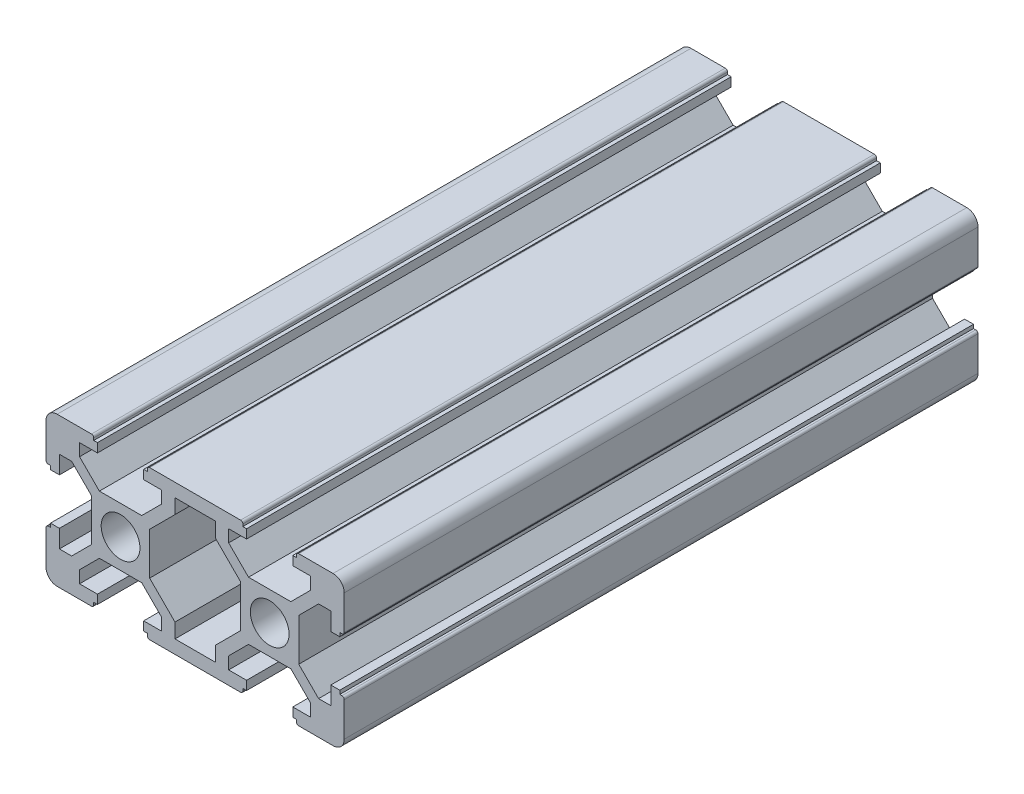
from build123d import *

# Parameters (mm, degrees)
SKETCH_1_R      = 2.6
EXTRUDE_1_DEPTH = 42.5
FILLET_1_R      = 1.5
FILLET_2_R      = 0.3


with BuildPart() as part:
    # 草图1 → 凸台-拉伸1 (new, symmetric)
    with BuildSketch(Plane.XY):
        Polygon((-13.9, 0), (-13.9, 2.839339828), (-16.560660172, 5.5), (-18.2, 5.5), (-18.2, 3.1), (-19.4, 3.1), (-19.4, 3.6), (-20, 3.6), (-20, 10), (-13.6, 10), (-13.6, 9.4), (-13.1, 9.4), (-13.1, 8.2), (-15.5, 8.2), (-15.5, 6.560660172), (-12.839339828, 3.9), (-7.160660172, 3.9), (-4.5, 6.560660172), (-4.5, 8.2), (-6.9, 8.2), (-6.9, 9.4), (-6.4, 9.4), (-6.4, 10), (6.4, 10), (6.4, 9.4), (6.9, 9.4), (6.9, 8.2), (4.5, 8.2), (4.5, 6.560660172), (7.160660172, 3.9), (12.839339828, 3.9), (15.5, 6.560660172), (15.5, 8.2), (13.1, 8.2), (13.1, 9.4), (13.6, 9.4), (13.6, 10), (20, 10), (20, 3.6), (19.4, 3.6), (19.4, 3.1), (18.2, 3.1), (18.2, 5.5), (16.560660172, 5.5), (13.9, 2.839339828), (13.9, 0), (13.9, -2.839339828), (16.560660172, -5.5), (18.2, -5.5), (18.2, -3.1), (19.4, -3.1), (19.4, -3.6), (20, -3.6), (20, -10), (13.6, -10), (13.6, -9.4), (13.1, -9.4), (13.1, -8.2), (15.5, -8.2), (15.5, -6.560660172), (12.839339828, -3.9), (7.160660172, -3.9), (4.5, -6.560660172), (4.5, -8.2), (6.9, -8.2), (6.9, -9.4), (6.4, -9.4), (6.4, -10), (-6.4, -10), (-6.4, -9.4), (-6.9, -9.4), (-6.9, -8.2), (-4.5, -8.2), (-4.5, -6.560660172), (-7.160660172, -3.9), (-12.839339828, -3.9), (-15.5, -6.560660172), (-15.5, -8.2), (-13.1, -8.2), (-13.1, -9.4), (-13.6, -9.4), (-13.6, -10), (-20, -10), (-20, -3.6), (-19.4, -3.6), (-19.4, -3.1), (-18.2, -3.1), (-18.2, -5.5), (-16.560660172, -5.5), (-13.9, -2.839339828), align=None)
        with Locations((-10, 0)):
            Circle(SKETCH_1_R, mode=Mode.SUBTRACT)
        with Locations(Location((10, 0, 0), (0, 0, 180))):
            Circle(SKETCH_1_R, mode=Mode.SUBTRACT)
        Polygon((-6.1, -2.839339828), (-6.1, 2.839339828), (-2.7, 6.239339828), (-2.7, 8.2), (2.7, 8.2), (2.7, 6.239339828), (6.1, 2.839339828), (6.1, -2.839339828), (2.7, -6.239339828), (2.7, -8.2), (-2.7, -8.2), (-2.7, -6.239339828), align=None, mode=Mode.SUBTRACT)
    extrude(amount=EXTRUDE_1_DEPTH, both=True)

    # 圆角1
    fillet_1_edges = [part.edges().sort_by_distance(p)[0] for p in [
        (-20, 10, 0),
        (20, 10, 0),
        (20, -10, 0),
        (-20, -10, 0),
    ]]
    fillet(fillet_1_edges, radius=FILLET_1_R)

    # 圆角2
    fillet_2_edges = [part.edges().sort_by_distance(p)[0] for p in [
        (-20, 3.6, 0),
        (-13.6, 10, 0),
        (-6.4, 10, 0),
        (6.4, 10, 0),
        (13.6, 10, 0),
        (20, 3.6, 0),
        (20, -3.6, 0),
        (13.6, -10, 0),
        (6.4, -10, 0),
        (-6.4, -10, 0),
        (-13.6, -10, 0),
        (-20, -3.6, 0),
    ]]
    fillet(fillet_2_edges, radius=FILLET_2_R)


solid = part.part
